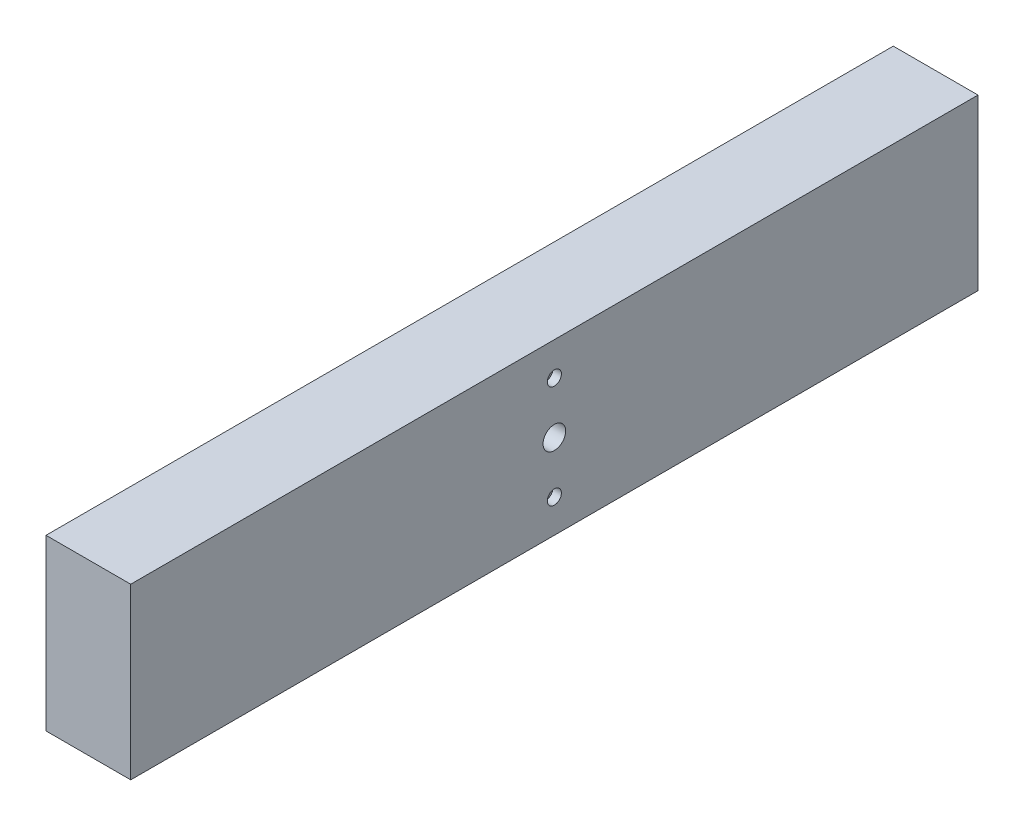
from build123d import *

# Parameters (mm, degrees)
BOSS_EXTRUDE1_DEPTH      = 150
BOSS_EXTRUDE1_DEPTH_BACK = 150
SKETCH1_W                = 30
SKETCH1_H                = 60
SKETCH2_R                = 2.5
CUT_EXTRUDE1_DEPTH       = 3
SKETCH3_R                = 4
CUT_EXTRUDE2_DEPTH       = 156.884572681


with BuildPart() as part:
    # Sketch1 → Boss-Extrude1 (new, two sides: drawn at the far end of the back side and taken through both)
    with BuildSketch(Plane.XY.offset(-BOSS_EXTRUDE1_DEPTH_BACK)):
        Rectangle(SKETCH1_W, SKETCH1_H)
    extrude(amount=BOSS_EXTRUDE1_DEPTH + BOSS_EXTRUDE1_DEPTH_BACK)

    # Sketch2 → Cut-Extrude1 (cut)
    with BuildSketch(Plane(origin=(15, 0, 0), x_dir=(0, 0, -1), z_dir=(1, 0, 0))):
        with Locations((0, 18.25)):
            Circle(SKETCH2_R)
        with Locations((0, -18.25)):
            Circle(SKETCH2_R)
    extrude(amount=-CUT_EXTRUDE1_DEPTH, mode=Mode.SUBTRACT)

    # Sketch3 → Cut-Extrude2 (cut, through all)
    with BuildSketch(Plane(origin=(15, 0, 0), x_dir=(0, 0, -1), z_dir=(1, 0, 0))):
        Circle(SKETCH3_R)
    extrude(amount=-CUT_EXTRUDE2_DEPTH, mode=Mode.SUBTRACT)


solid = part.part
